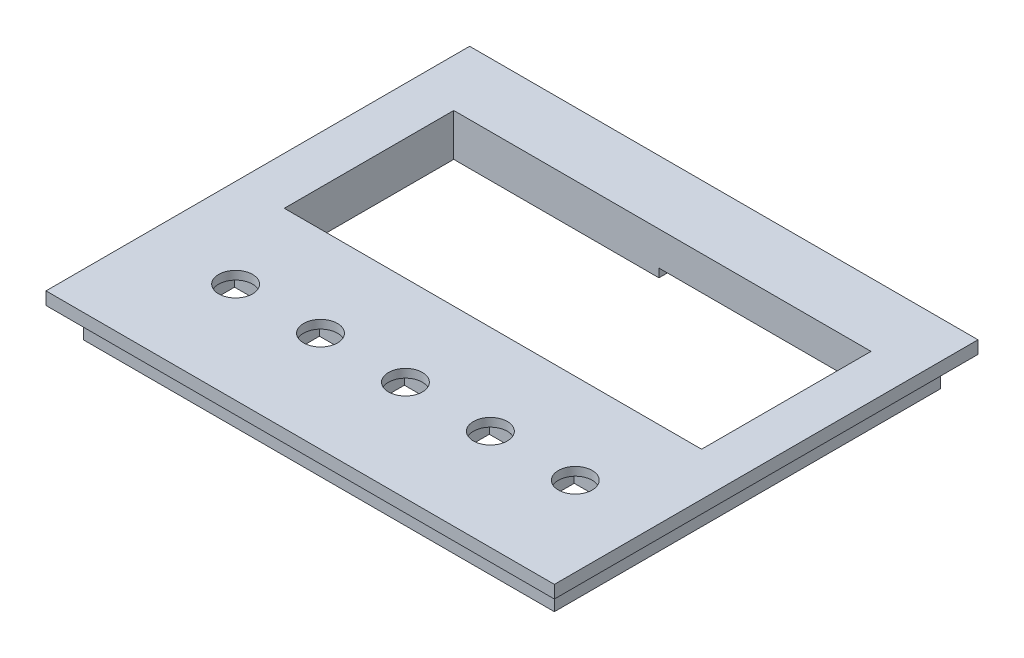
from build123d import *

# Parameters (mm, degrees)
SKETCH1_W           = 120
SKETCH1_H           = 100
BOSS_EXTRUDE1_DEPTH = 10
SKETCH2_W           = 98.5
SKETCH2_H           = 40
CUT_EXTRUDE1_DEPTH  = 10
SKETCH3_W           = 120
SKETCH3_H           = 100
SKETCH3_W_2         = 111.2
SKETCH3_H_2         = 91.2
CUT_EXTRUDE3_DEPTH  = 7
SKETCH4_W           = 18
SKETCH4_H           = 25
CUT_EXTRUDE4_DEPTH  = 8
SKETCH5_W           = 3
SKETCH5_H           = 25
CUT_EXTRUDE6_DEPTH  = 1
SKETCH6_R           = 4
CUT_EXTRUDE12_DEPTH = 81.067810822
SKETCH7_W           = 45.061320755
SKETCH7_H           = 5
CUT_EXTRUDE13_DEPTH = 2


with BuildPart() as part:
    # Sketch1 → Boss-Extrude1 (new body)
    with BuildSketch(Plane(origin=(0, 0, 0), x_dir=(1, 0, 0), z_dir=(0, 1, 0))):
        with Locations((0.311320755, 2.051886792)):
            Rectangle(SKETCH1_W, SKETCH1_H)
    extrude(amount=BOSS_EXTRUDE1_DEPTH)

    # Sketch2 → Cut-Extrude1 (cut)
    with BuildSketch(Plane(origin=(0, 10, 0), x_dir=(1, 0, 0), z_dir=(0, 1, 0))):
        with Locations((0.811320755, 17.051886792)):
            Rectangle(SKETCH2_W, SKETCH2_H)
    extrude(amount=-CUT_EXTRUDE1_DEPTH, mode=Mode.SUBTRACT)

    # Sketch3 → Cut-Extrude3 (cut)
    with BuildSketch(Plane.XZ):
        with Locations((0.311320755, -2.051886792)):
            Rectangle(SKETCH3_W, SKETCH3_H)
        with Locations((0.311320755, -2.051886792)):
            Rectangle(SKETCH3_W_2, SKETCH3_H_2, mode=Mode.SUBTRACT)
    extrude(amount=-CUT_EXTRUDE3_DEPTH, mode=Mode.SUBTRACT)

    # Sketch4 → Cut-Extrude4 (cut)
    with BuildSketch(Plane.XZ):
        with Locations((-39.17934754, 27.448113208)):
            Rectangle(SKETCH4_W, SKETCH4_H)
        with Locations((-19.133803456, 27.448113208)):
            Rectangle(SKETCH4_W, SKETCH4_H)
        with Locations((0.911740628, 27.448113208)):
            Rectangle(SKETCH4_W, SKETCH4_H)
        with Locations((20.957284712, 27.448113208)):
            Rectangle(SKETCH4_W, SKETCH4_H)
        with Locations((41.002828796, 27.448113208)):
            Rectangle(SKETCH4_W, SKETCH4_H)
    extrude(amount=-CUT_EXTRUDE4_DEPTH, mode=Mode.SUBTRACT)

    # Sketch5 → Cut-Extrude6 (cut)
    with BuildSketch(Plane.XZ.offset(-8)):
        with Locations((33.502828796, 27.448113208)):
            Rectangle(SKETCH5_W, SKETCH5_H)
        with Locations((13.457284712, 27.448113208)):
            Rectangle(SKETCH5_W, SKETCH5_H)
        with Locations((-6.588259372, 27.448113208)):
            Rectangle(SKETCH5_W, SKETCH5_H)
        with Locations((-26.633803456, 27.448113208)):
            Rectangle(SKETCH5_W, SKETCH5_H)
        with Locations((-46.67934754, 27.448113208)):
            Rectangle(SKETCH5_W, SKETCH5_H)
    extrude(amount=-CUT_EXTRUDE6_DEPTH, mode=Mode.SUBTRACT)

    # Sketch6 → Cut-Extrude12 (cut, through all)
    with BuildSketch(Plane.XZ.offset(-8)):
        with Locations(Location((41.502828796, 24.198113208, 0), (0, 0, 270))):
            Circle(SKETCH6_R)
        with Locations(Location((21.457284712, 24.198113208, 0), (0, 0, 270))):
            Circle(SKETCH6_R)
        with Locations(Location((1.411740628, 24.198113208, 0), (0, 0, 270))):
            Circle(SKETCH6_R)
        with Locations(Location((-18.633803456, 24.198113208, 0), (0, 0, 270))):
            Circle(SKETCH6_R)
        with Locations(Location((-38.67934754, 24.198113208, 0), (0, 0, 270))):
            Circle(SKETCH6_R)
    extrude(amount=-CUT_EXTRUDE12_DEPTH, mode=Mode.SUBTRACT)

    # Sketch7 → Cut-Extrude13 (cut)
    with BuildSketch(Plane.XZ):
        with Locations((22.530660378, -39.551886792)):
            Rectangle(SKETCH7_W, SKETCH7_H)
    extrude(amount=-CUT_EXTRUDE13_DEPTH, mode=Mode.SUBTRACT)


solid = part.part
